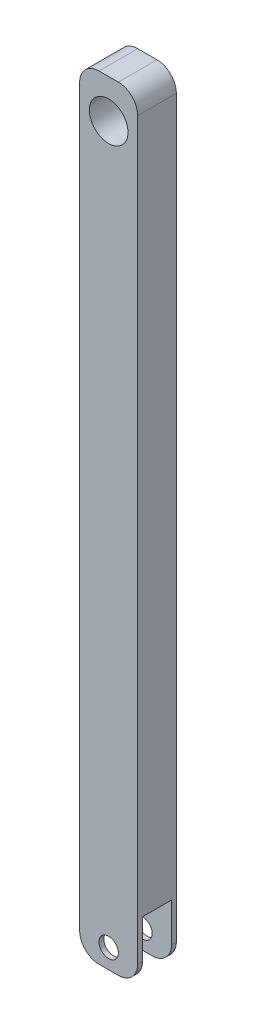
from build123d import *

# Parameters (mm, degrees)
SKETCH1_W           = 76.2
SKETCH1_H           = 50.8
BOSS_EXTRUDE2_DEPTH = 1016
SKETCH2_R           = 25.4
CUT_EXTRUDE1_DEPTH  = 1016
FILLET1_R           = 25.4
SKETCH3_R           = 12.7
CUT_EXTRUDE2_DEPTH  = 254
SKETCH4_W           = 38.1
SKETCH4_H           = 50.8
CUT_EXTRUDE3_DEPTH  = 254
SKETCH5_W           = 38.1
SKETCH5_H           = 25.4
CUT_EXTRUDE4_DEPTH  = 254
FILLET2_R           = 25.4


with BuildPart() as part:
    # Sketch1 → Boss-Extrude2 (new body)
    with BuildSketch(Plane(origin=(0, 0, 0), x_dir=(1, 0, 0), z_dir=(0, 1, 0))):
        with Locations((38.1, -25.4)):
            Rectangle(SKETCH1_W, SKETCH1_H)
    extrude(amount=BOSS_EXTRUDE2_DEPTH)

    # Sketch2 → Cut-Extrude1 (cut)
    with BuildSketch(Plane.XY.offset(50.8)):
        with Locations((38.1, 965.2)):
            Circle(SKETCH2_R)
    extrude(amount=-CUT_EXTRUDE1_DEPTH, mode=Mode.SUBTRACT)

    # Fillet1
    fillet1_edges = [part.edges().sort_by_distance(p)[0] for p in [
        (76.2, 1016, 25.4),
        (0, 1016, 25.4),
    ]]
    fillet(fillet1_edges, radius=FILLET1_R)

    # Sketch3 → Cut-Extrude2 (cut)
    with BuildSketch(Plane.XY.offset(50.8)):
        with Locations((38.1, 25.4)):
            Circle(SKETCH3_R)
    extrude(amount=-CUT_EXTRUDE2_DEPTH, mode=Mode.SUBTRACT)

    # Sketch4 → Cut-Extrude3 (cut)
    with BuildSketch(Plane.ZY):
        with Locations((25.4, 25.4)):
            Rectangle(SKETCH4_W, SKETCH4_H)
    extrude(amount=-CUT_EXTRUDE3_DEPTH, mode=Mode.SUBTRACT)

    # Sketch5 → Cut-Extrude4 (cut)
    with BuildSketch(Plane.ZY):
        with Locations((25.4, 63.5)):
            Rectangle(SKETCH5_W, SKETCH5_H)
    extrude(amount=-CUT_EXTRUDE4_DEPTH, mode=Mode.SUBTRACT)

    # Fillet2
    fillet2_edges = [part.edges().sort_by_distance(p)[0] for p in [
        (0, 0, 47.625),
        (76.2, 0, 3.175),
        (76.2, 0, 47.625),
        (0, 0, 3.175),
    ]]
    fillet(fillet2_edges, radius=FILLET2_R)


solid = part.part
